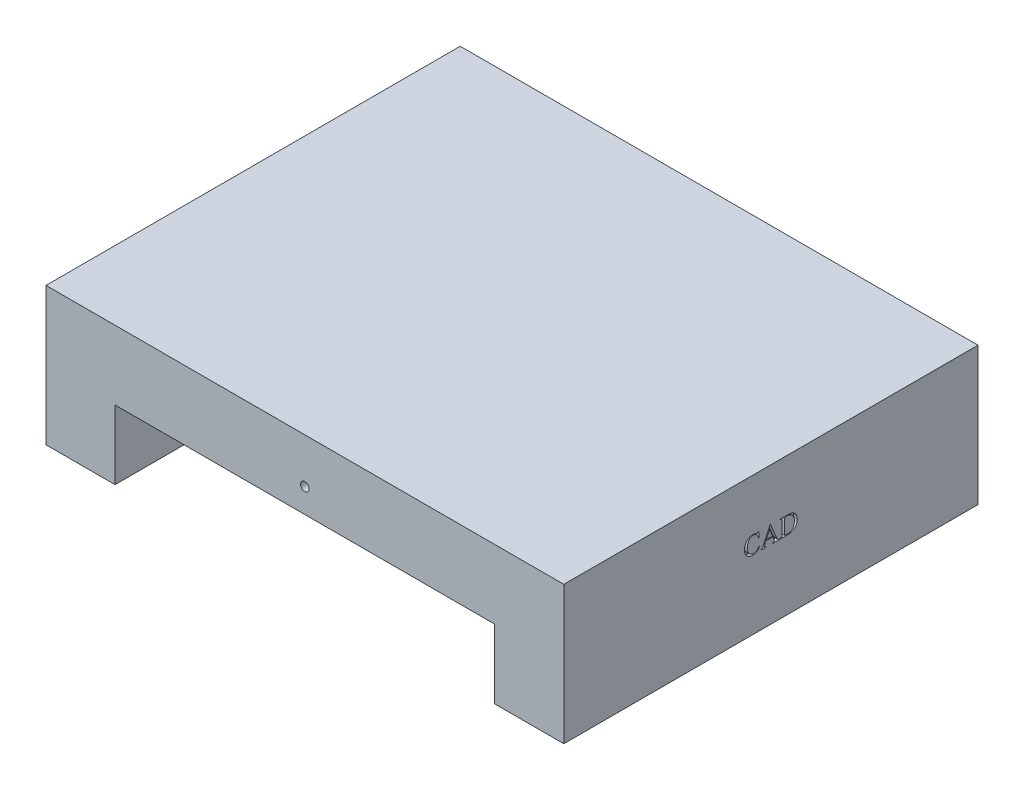
from build123d import *

# Parameters (mm, degrees)
SKETCH1_W           = 150
SKETCH1_H           = 40
BOSS_EXTRUDE1_DEPTH = 60
SKETCH2_W           = 110
SKETCH2_H           = 20
CUT_EXTRUDE1_DEPTH  = 143.91605928
SKETCH3_R           = 1.25
CUT_EXTRUDE2_DEPTH  = 5
CUT_EXTRUDE3_DEPTH  = 1


with BuildPart() as part:
    # Sketch1 → Boss-Extrude1 (new, symmetric)
    with BuildSketch(Plane.XY):
        Rectangle(SKETCH1_W, SKETCH1_H)
    extrude(amount=BOSS_EXTRUDE1_DEPTH, both=True)

    # Sketch2 → Cut-Extrude1 (cut, through all)
    with BuildSketch(Plane.XY.offset(60)):
        with Locations((0, -10)):
            Rectangle(SKETCH2_W, SKETCH2_H)
    extrude(amount=-CUT_EXTRUDE1_DEPTH, mode=Mode.SUBTRACT)

    # Sketch3 → Cut-Extrude2 (cut)
    with BuildSketch(Plane.XY.offset(60)):
        with Locations((0, 7)):
            Circle(SKETCH3_R)
    extrude(amount=-CUT_EXTRUDE2_DEPTH, mode=Mode.SUBTRACT)

    # Sketch4 → Cut-Extrude3 (cut)
    # profile 1 of 3: a face of its own
    with BuildSketch(Plane(origin=(75, 0, 0), x_dir=(0, 0, -1), z_dir=(1, 0, 0))):
        with BuildLine():
            Line((-3.541666667, 5.069444444), (-3.402777778, 3.333333333))
            Line((-3.402777778, 3.333333333), (-3.541666667, 3.333333333))
            add(Edge.make_bspline(
                [(-3.541666667, 3.333333333), (-3.560127797, 3.399019648), (-3.595893554, 3.526277332), (-3.659666525, 3.708188694), (-3.72687542, 3.876622986), (-3.80227413, 4.030002755), (-3.882169582, 4.169862856), (-3.969191355, 4.294933132), (-4.061446842, 4.406359345), (-4.159647569, 4.503713276), (-4.263693084, 4.587758073), (-4.372377784, 4.660574141), (-4.485902518, 4.72297205), (-4.604543404, 4.774290321), (-4.728887016, 4.813670152), (-4.858484508, 4.839782023), (-4.992585977, 4.858539417), (-5.083844223, 4.860244724), (-5.130208333, 4.861111111)],
                knots=[0, 0, 0, 0, 1.365306606, 2.645083058, 3.856296657, 4.992683601, 6.063002854, 7.077131597, 8.038305781, 8.954596039, 9.839848101, 10.711227855, 11.569763097, 12.429061007, 13.294496621, 14.174761977, 15.072680662, 16, 16, 16, 16], degree=3))
            add(Edge.make_bspline(
                [(-5.130208333, 4.861111111), (-5.169287844, 4.860089442), (-5.246507093, 4.858070671), (-5.360883492, 4.847678613), (-5.472048479, 4.8275014), (-5.580824898, 4.801086562), (-5.686129552, 4.764183666), (-5.789791277, 4.722690801), (-5.889530348, 4.671063555), (-5.986658971, 4.612448815), (-6.079895988, 4.545370393), (-6.168442528, 4.469056114), (-6.250695552, 4.382880321), (-6.328676248, 4.287686666), (-6.400174828, 4.182334195), (-6.469732236, 4.069550336), (-6.530813132, 3.945799573), (-6.588653986, 3.813990541), (-6.639210104, 3.672821607), (-6.683765793, 3.523606878), (-6.721903181, 3.366486083), (-6.751481957, 3.200376693), (-6.777442138, 3.026490305), (-6.79218997, 2.843423536), (-6.804207347, 2.652791522), (-6.805100567, 2.522808163), (-6.805555556, 2.456597222)],
                knots=[0, 0, 0, 0, 0.852545564, 1.684589362, 2.501652392, 3.314783632, 4.123040609, 4.933143274, 5.748109165, 6.569312519, 7.405645712, 8.25016084, 9.114918083, 10.000754889, 10.930732154, 11.889927012, 12.888317242, 13.937610583, 15.028084188, 16.156171809, 17.332859433, 18.552090647, 19.835038534, 21.165583881, 22.556204723, 24, 24, 24, 24], degree=3))
            add(Edge.make_bspline(
                [(-6.805555556, 2.456597222), (-6.804946869, 2.401605833), (-6.803748531, 2.293342773), (-6.793819055, 2.134039228), (-6.777574592, 1.980162537), (-6.754944485, 1.832039691), (-6.726034828, 1.689130362), (-6.688544954, 1.552541535), (-6.646524944, 1.420863258), (-6.598146101, 1.294702841), (-6.541430788, 1.175857854), (-6.479663213, 1.062934068), (-6.410200288, 0.957804512), (-6.33376384, 0.859723869), (-6.2514189, 0.768334354), (-6.162155265, 0.684467281), (-6.066030391, 0.608356468), (-5.964210791, 0.538953857), (-5.856940358, 0.477090531), (-5.745110622, 0.42395381), (-5.629592775, 0.379544139), (-5.510746875, 0.342424594), (-5.388278397, 0.313039481), (-5.261719437, 0.292415184), (-5.131523556, 0.28051361), (-5.043426681, 0.278696094), (-4.998914931, 0.277777778)],
                knots=[0, 0, 0, 0, 1.236646645, 2.434620225, 3.588021171, 4.71542926, 5.803413575, 6.864987612, 7.89909351, 8.911178466, 9.900886288, 10.858450138, 11.803739474, 12.731186558, 13.652621421, 14.567606934, 15.482266978, 16.407285251, 17.336514176, 18.264317902, 19.188799549, 20.117565524, 21.062609844, 22.018756131, 22.998958452, 24, 24, 24, 24], degree=3))
            add(Edge.make_bspline(
                [(-4.998914931, 0.277777778), (-4.922799118, 0.27985346), (-4.773966265, 0.283912139), (-4.557884156, 0.321965574), (-4.355251978, 0.382410079), (-4.196194366, 0.454594439), (-4.074860643, 0.528837328), (-3.980806535, 0.595266272), (-3.885754729, 0.675090232), (-3.787987089, 0.766393808), (-3.688371129, 0.870218925), (-3.584882083, 0.98478028), (-3.481463369, 1.113194093), (-3.413030322, 1.203524539), (-3.377821181, 1.25)],
                knots=[0, 0, 0, 0, 1.384369864, 2.706923932, 3.979392615, 5.225429667, 5.872362172, 6.566477539, 7.319183729, 8.12964106, 9.000244434, 9.937306366, 10.938733914, 12, 12, 12, 12], degree=3))
            Line((-3.377821181, 1.25), (-3.263888889, 1.180555556))
            add(Edge.make_bspline(
                [(-3.263888889, 1.180555556), (-3.294546158, 1.128200251), (-3.354758755, 1.025371494), (-3.450927393, 0.878788128), (-3.55209564, 0.743650218), (-3.657845328, 0.619982896), (-3.765604923, 0.50561585), (-3.87846188, 0.403169075), (-3.994014584, 0.310265407), (-4.115519049, 0.229998829), (-4.240729684, 0.158779484), (-4.371892922, 0.097914464), (-4.508197793, 0.045983661), (-4.65027668, 0.003201252), (-4.79839671, -0.028918323), (-4.951989518, -0.052770644), (-5.111480349, -0.067307385), (-5.219514938, -0.068723437), (-5.274522569, -0.069444444)],
                knots=[0, 0, 0, 0, 1.164115463, 2.286388121, 3.362177995, 4.401064794, 5.407448869, 6.375280312, 7.323730291, 8.2496411, 9.166480924, 10.085577234, 11.021398032, 11.963401182, 12.930012424, 13.927332932, 14.944666635, 16, 16, 16, 16], degree=3))
            add(Edge.make_bspline(
                [(-5.274522569, -0.069444444), (-5.324096727, -0.068939471), (-5.421921899, -0.067943003), (-5.56638095, -0.056433326), (-5.706963831, -0.039400567), (-5.843346858, -0.014912775), (-5.975062745, 0.018821425), (-6.103441395, 0.055248247), (-6.226329856, 0.103260215), (-6.34551672, 0.155678457), (-6.460321814, 0.216030543), (-6.571088451, 0.283093113), (-6.67730899, 0.358244506), (-6.779457497, 0.439774501), (-6.8776781, 0.527806327), (-6.97092707, 0.624023559), (-7.061207281, 0.726269572), (-7.116361323, 0.799674584), (-7.144097222, 0.836588542)],
                knots=[0, 0, 0, 0, 1.099867591, 2.170379506, 3.21370673, 4.241732154, 5.242319988, 6.230208013, 7.200627964, 8.167156574, 9.118536317, 10.076596279, 11.038581839, 12.003776478, 12.975622664, 13.963217193, 14.975741399, 16, 16, 16, 16], degree=3))
            add(Edge.make_bspline(
                [(-7.144097222, 0.836588542), (-7.183857385, 0.893424339), (-7.26281022, 1.006284724), (-7.362425055, 1.187483556), (-7.448602812, 1.374660437), (-7.518173052, 1.570481454), (-7.572699945, 1.773254504), (-7.609753065, 1.98391273), (-7.635082512, 2.201351616), (-7.637607909, 2.349100898), (-7.638888889, 2.424045139)],
                knots=[0, 0, 0, 0, 0.983524538, 1.953011393, 2.929009533, 3.904562341, 4.897931762, 5.904535192, 6.937097918, 8, 8, 8, 8], degree=3))
            add(Edge.make_bspline(
                [(-7.638888889, 2.424045139), (-7.637679207, 2.484833363), (-7.635285467, 2.605122268), (-7.621247854, 2.783806287), (-7.596600728, 2.958574943), (-7.559908779, 3.129255315), (-7.516117843, 3.297044039), (-7.46041206, 3.460671155), (-7.395373082, 3.620557223), (-7.320272394, 3.775410285), (-7.237642662, 3.92500264), (-7.144913191, 4.065712289), (-7.04625044, 4.198839844), (-6.939602001, 4.32281792), (-6.825427191, 4.438161898), (-6.703584062, 4.544769734), (-6.574112032, 4.642636436), (-6.437727993, 4.731393969), (-6.295683506, 4.810181586), (-6.150286975, 4.880080499), (-6.001229025, 4.938775426), (-5.848947954, 4.986646752), (-5.693731323, 5.02359376), (-5.535240941, 5.049360935), (-5.373637229, 5.066445014), (-5.264438885, 5.068439504), (-5.209418403, 5.069444444)],
                knots=[0, 0, 0, 0, 1.092083487, 2.161035764, 3.217773312, 4.260190825, 5.295679875, 6.331270849, 7.362920202, 8.394590017, 9.421399, 10.430623911, 11.419565072, 12.396371527, 13.365824252, 14.332813307, 15.302266032, 16.279072486, 17.253498857, 18.218389939, 19.175218244, 20.128753647, 21.083815363, 22.038788663, 23.011827579, 24, 24, 24, 24], degree=3))
            add(Edge.make_bspline(
                [(-5.209418403, 5.069444444), (-5.123169974, 5.06703775), (-4.950105444, 5.062208521), (-4.692543025, 5.019769592), (-4.436087364, 4.95468338), (-4.270952685, 4.889697558), (-4.187282986, 4.856770833)],
                knots=[0, 0, 0, 0, 0.984356359, 1.975191602, 2.974079167, 4, 4, 4, 4], degree=3))
            add(Edge.make_bspline(
                [(-4.187282986, 4.856770833), (-4.164592539, 4.84711199), (-4.122843604, 4.829340352), (-4.064997545, 4.808783687), (-4.017502596, 4.795351201), (-3.98913298, 4.792784381), (-3.976779514, 4.791666667)],
                knots=[0, 0, 0, 0, 1.336236462, 2.458587416, 3.328796419, 4, 4, 4, 4], degree=3))
            add(Edge.make_bspline(
                [(-3.976779514, 4.791666667), (-3.94627596, 4.793899801), (-3.886010248, 4.798311792), (-3.835639453, 4.831634094), (-3.810763889, 4.848090278)],
                knots=[0, 0, 0, 0, 1.012302122, 2, 2, 2, 2], degree=3))
            add(Edge.make_bspline(
                [(-3.810763889, 4.848090278), (-3.79608402, 4.862065295), (-3.766097958, 4.890611581), (-3.731233143, 4.943688415), (-3.700766592, 5.00312141), (-3.68747169, 5.046748972), (-3.680555556, 5.069444444)],
                knots=[0, 0, 0, 0, 0.931295945, 1.90232619, 2.908770141, 4, 4, 4, 4], degree=3))
            Line((-3.680555556, 5.069444444), (-3.541666667, 5.069444444))
        make_face()
    # profile 2 of 3: a face of its own
    with BuildSketch(Plane(origin=(75, 0, 0), x_dir=(0, 0, -1), z_dir=(1, 0, 0))):
        with BuildLine():
            Line((0.553385417, 1.666666667), (-1.439887153, 1.666666667))
            Line((-1.439887153, 1.666666667), (-1.805555556, 0.87890625))
            add(Edge.make_bspline(
                [(-1.805555556, 0.87890625), (-1.824230869, 0.834270326), (-1.858675129, 0.751944998), (-1.897877851, 0.635356662), (-1.924655467, 0.53685188), (-1.928595018, 0.476103923), (-1.930338542, 0.44921875)],
                knots=[0, 0, 0, 0, 1.290094603, 2.37941668, 3.282779777, 4, 4, 4, 4], degree=3))
            add(Edge.make_bspline(
                [(-1.930338542, 0.44921875), (-1.92925002, 0.430544653), (-1.927086893, 0.393435217), (-1.904089803, 0.340600358), (-1.870066397, 0.291462139), (-1.830963184, 0.253745589), (-1.790534833, 0.227446196), (-1.751595142, 0.20873886), (-1.704562511, 0.192741133), (-1.649556642, 0.17936528), (-1.586981319, 0.166198263), (-1.51688411, 0.153936637), (-1.438509503, 0.146056707), (-1.383829045, 0.141349163), (-1.355251736, 0.138888889)],
                knots=[0, 0, 0, 0, 0.928346294, 1.844823155, 2.832693264, 3.906787277, 4.533555799, 5.236980931, 6.060283213, 7.011752617, 8.064797478, 9.256587662, 10.566227436, 12, 12, 12, 12], degree=3))
            Line((-1.355251736, 0.138888889), (-1.355251736, 0))
            Line((-1.355251736, 0), (-2.925347222, 0))
            Line((-2.925347222, 0), (-2.925347222, 0.138888889))
            add(Edge.make_bspline(
                [(-2.925347222, 0.138888889), (-2.87777174, 0.148641637), (-2.791273973, 0.16637327), (-2.676142756, 0.200451126), (-2.58668341, 0.2382559), (-2.542172289, 0.273345832), (-2.522786458, 0.288628472)],
                knots=[0, 0, 0, 0, 1.341417684, 2.438853554, 3.320077337, 4, 4, 4, 4], degree=3))
            add(Edge.make_bspline(
                [(-2.522786458, 0.288628472), (-2.50658002, 0.305734104), (-2.472102733, 0.342124319), (-2.423141844, 0.406084632), (-2.373699828, 0.482203687), (-2.323078756, 0.570084331), (-2.270790897, 0.669709093), (-2.216817202, 0.780616703), (-2.162536998, 0.904331821), (-2.126914148, 0.990953871), (-2.108289931, 1.036241319)],
                knots=[0, 0, 0, 0, 0.657509844, 1.398774721, 2.244567789, 3.190193186, 4.229071695, 5.385194885, 6.63293641, 8, 8, 8, 8], degree=3))
            Line((-2.108289931, 1.036241319), (-0.233289931, 5.069444444))
            Line((-0.233289931, 5.069444444), (-0.096571181, 5.069444444))
            Line((-0.096571181, 5.069444444), (1.597222222, 0.948350694))
            add(Edge.make_bspline(
                [(1.597222222, 0.948350694), (1.613860368, 0.908763224), (1.645859565, 0.8326269), (1.697738836, 0.725542754), (1.745503316, 0.627837005), (1.793519951, 0.541774576), (1.839955181, 0.466614861), (1.885412105, 0.402298008), (1.929683964, 0.348566682), (1.988010143, 0.291545086), (2.069103635, 0.23385532), (2.182244256, 0.185997065), (2.310467224, 0.151590625), (2.402112277, 0.143253318), (2.450086806, 0.138888889)],
                knots=[0, 0, 0, 0, 1.223989839, 2.354029848, 3.391605643, 4.324042249, 5.162387765, 5.909171864, 6.567979791, 7.144041755, 8.231258465, 9.380841669, 10.628917946, 12, 12, 12, 12], degree=3))
            Line((2.450086806, 0.138888889), (2.450086806, 0))
            Line((2.450086806, 0), (0.476345486, 0))
            Line((0.476345486, 0), (0.476345486, 0.138888889))
            add(Edge.make_bspline(
                [(0.476345486, 0.138888889), (0.522049976, 0.141824368), (0.606024478, 0.14721783), (0.719030328, 0.169038273), (0.809780901, 0.196150186), (0.876855371, 0.236457974), (0.924319725, 0.284052367), (0.957621621, 0.335863297), (0.978422108, 0.392733035), (0.980790299, 0.432410056), (0.981987847, 0.452473958)],
                knots=[0, 0, 0, 0, 1.654818352, 3.040457217, 4.157564338, 5.061856313, 5.838989301, 6.56851638, 7.276126429, 8, 8, 8, 8], degree=3))
            add(Edge.make_bspline(
                [(0.981987847, 0.452473958), (0.980038239, 0.484446256), (0.975594755, 0.557316492), (0.943177106, 0.676865048), (0.898558521, 0.821007303), (0.857661232, 0.923307415), (0.835503472, 0.978732639)],
                knots=[0, 0, 0, 0, 0.698820548, 1.592729354, 2.695763756, 4, 4, 4, 4], degree=3))
            Line((0.835503472, 0.978732639), (0.553385417, 1.666666667))
        make_face()
        Polygon((0.467664931, 1.875), (-0.381944444, 3.882378472), (-1.343315972, 1.875), align=None, mode=Mode.SUBTRACT)
    # profile 3 of 3: a face of its own
    with BuildSketch(Plane(origin=(75, 0, 0), x_dir=(0, 0, -1), z_dir=(1, 0, 0))):
        with BuildLine():
            Line((2.569444444, 0), (2.569444444, 0.138888889))
            Line((2.569444444, 0.138888889), (2.750651042, 0.138888889))
            add(Edge.make_bspline(
                [(2.750651042, 0.138888889), (2.775279414, 0.139470136), (2.822934507, 0.14059483), (2.891719334, 0.150464302), (2.955082596, 0.166667026), (3.013066457, 0.189038716), (3.064518238, 0.219421682), (3.112167037, 0.253570209), (3.152665345, 0.296770037), (3.174633003, 0.329535222), (3.185763889, 0.346137153)],
                knots=[0, 0, 0, 0, 1.170016541, 2.263943595, 3.293731011, 4.273677885, 5.205400736, 6.126759273, 7.050839703, 8, 8, 8, 8], degree=3))
            add(Edge.make_bspline(
                [(3.185763889, 0.346137153), (3.192233993, 0.357923738), (3.206477371, 0.383870895), (3.222184583, 0.43001288), (3.234544886, 0.485396026), (3.245515106, 0.550230255), (3.253685032, 0.624507732), (3.260519051, 0.70879714), (3.263219646, 0.802572191), (3.263659404, 0.868417057), (3.263888889, 0.902777778)],
                knots=[0, 0, 0, 0, 0.568141805, 1.250715472, 2.052584266, 2.968455247, 4.031571596, 5.213625719, 6.545948453, 8, 8, 8, 8], degree=3))
            Line((3.263888889, 0.902777778), (3.263888889, 4.097222222))
            add(Edge.make_bspline(
                [(3.263888889, 4.097222222), (3.263939844, 4.135211574), (3.264036478, 4.207256974), (3.257815317, 4.309974656), (3.251005434, 4.401645773), (3.240368143, 4.482102399), (3.226502492, 4.551503747), (3.209226597, 4.609412995), (3.190986458, 4.658121421), (3.172541565, 4.683451378), (3.1640625, 4.695095486)],
                knots=[0, 0, 0, 0, 1.484107705, 2.814555366, 4.019988359, 5.075390106, 5.984573864, 6.780592097, 7.4394417, 8, 8, 8, 8], degree=3))
            add(Edge.make_bspline(
                [(3.1640625, 4.695095486), (3.139179083, 4.720769101), (3.08915632, 4.772380387), (2.99050509, 4.824963958), (2.875796819, 4.855284584), (2.793897101, 4.859097665), (2.750651042, 4.861111111)],
                knots=[0, 0, 0, 0, 0.928124107, 1.865794122, 2.873060895, 4, 4, 4, 4], degree=3))
            Line((2.750651042, 4.861111111), (2.569444444, 4.861111111))
            Line((2.569444444, 4.861111111), (2.569444444, 5))
            Line((2.569444444, 5), (4.618055556, 5))
            add(Edge.make_bspline(
                [(4.618055556, 5), (4.709215818, 4.999143286), (4.886191622, 4.997480087), (5.143131079, 4.985368329), (5.383558185, 4.966512035), (5.606593673, 4.938520283), (5.81297945, 4.902619962), (6.002805026, 4.860181466), (6.175757832, 4.808220383), (6.333132195, 4.747911984), (6.478950498, 4.678802027), (6.615342431, 4.598211044), (6.74488344, 4.507954507), (6.867563969, 4.407511187), (6.982057595, 4.29558276), (7.090192138, 4.173680556), (7.189959838, 4.040417353), (7.282847513, 3.898228279), (7.366406443, 3.747439541), (7.439022795, 3.589939165), (7.500936181, 3.426766986), (7.552365307, 3.257994763), (7.591410844, 3.083128512), (7.617611172, 2.902433124), (7.636297706, 2.716317475), (7.638016417, 2.590109006), (7.638888889, 2.526041667)],
                knots=[0, 0, 0, 0, 1.467398357, 2.848763231, 4.139747069, 5.348651221, 6.465709142, 7.510884705, 8.477890948, 9.369935066, 10.221521294, 11.072291092, 11.917022873, 12.760911509, 13.621447043, 14.491775058, 15.381421868, 16.298684439, 17.223858558, 18.153856654, 19.088127867, 20.031156851, 20.991691223, 21.969088183, 22.969046064, 24, 24, 24, 24], degree=3))
            add(Edge.make_bspline(
                [(7.638888889, 2.526041667), (7.637206894, 2.440583668), (7.633910105, 2.273082068), (7.602258339, 2.02735756), (7.552818592, 1.792360443), (7.483441138, 1.56755566), (7.392924594, 1.353956264), (7.282238983, 1.151294953), (7.154063172, 0.957494742), (7.05213786, 0.840233822), (7.000868056, 0.78125)],
                knots=[0, 0, 0, 0, 1.077719575, 2.112379846, 3.120154608, 4.104514829, 5.075810074, 6.041644454, 7.014920789, 8, 8, 8, 8], degree=3))
            add(Edge.make_bspline(
                [(7.000868056, 0.78125), (6.970538358, 0.74936335), (6.909663439, 0.685363463), (6.810744866, 0.596879349), (6.706475699, 0.514136775), (6.596150824, 0.437888252), (6.480273609, 0.367492585), (6.358293029, 0.303039293), (6.229963595, 0.246089109), (6.096591667, 0.193599574), (5.956931753, 0.148259958), (5.811844638, 0.108031889), (5.660470902, 0.074288194), (5.503191717, 0.047724008), (5.340393619, 0.0256958), (5.171679171, 0.010655104), (4.997196497, 0.002101176), (4.878843233, 0.000707248), (4.818793403, 0)],
                knots=[0, 0, 0, 0, 0.884547214, 1.775380039, 2.665826882, 3.559504879, 4.469980105, 5.390593375, 6.331323642, 7.291529335, 8.271228182, 9.282197471, 10.317896576, 11.387954191, 12.488469157, 13.620281033, 14.792583212, 16, 16, 16, 16], degree=3))
            Line((4.818793403, 0), (2.569444444, 0))
        make_face()
        with BuildLine():
            add(Edge.make_bspline(
                [(3.958333333, 0.314670139), (4.035221917, 0.298273802), (4.181921261, 0.26699046), (4.393972778, 0.235444417), (4.586085249, 0.212364085), (4.708058188, 0.209625735), (4.765625, 0.208333333)],
                knots=[0, 0, 0, 0, 1.156263879, 2.206090244, 3.153339526, 4, 4, 4, 4], degree=3))
            add(Edge.make_bspline(
                [(4.765625, 0.208333333), (4.83734737, 0.210121917), (4.978513977, 0.213642274), (5.185234016, 0.244027053), (5.383178125, 0.291375608), (5.571739606, 0.358864928), (5.750746707, 0.446202074), (5.919997702, 0.553153713), (6.078681198, 0.680412577), (6.228598684, 0.823803236), (6.363423151, 0.985319036), (6.482823049, 1.160780615), (6.582726881, 1.350596087), (6.664236379, 1.553998865), (6.72848522, 1.77081022), (6.773471295, 2.001871189), (6.801105547, 2.246502604), (6.80404946, 2.414204372), (6.805555556, 2.5)],
                knots=[0, 0, 0, 0, 0.997996022, 1.964292496, 2.902202989, 3.827540679, 4.746320531, 5.669683403, 6.608607029, 7.573643287, 8.552931756, 9.531909504, 10.522958759, 11.532773866, 12.577887131, 13.666093008, 14.805981493, 16, 16, 16, 16], degree=3))
            add(Edge.make_bspline(
                [(6.805555556, 2.5), (6.804052965, 2.586517745), (6.801121648, 2.755300207), (6.773594595, 3.001039925), (6.728328192, 3.232764515), (6.664223691, 3.450313775), (6.582945968, 3.654552824), (6.483069847, 3.844445231), (6.363449682, 4.019111092), (6.22814677, 4.179386682), (6.078871145, 4.323594647), (5.917650566, 4.449041171), (5.745816666, 4.554947854), (5.56406163, 4.642901831), (5.370423208, 4.708010295), (5.168126341, 4.757861955), (4.954853474, 4.78595614), (4.80946801, 4.789736596), (4.735243056, 4.791666667)],
                knots=[0, 0, 0, 0, 1.193396302, 2.328127765, 3.406675227, 4.447298146, 5.452780722, 6.435033879, 7.401194227, 8.367973033, 9.324444072, 10.259799173, 11.180785527, 12.104889921, 13.03919269, 13.994204462, 14.975963072, 16, 16, 16, 16], degree=3))
            add(Edge.make_bspline(
                [(4.735243056, 4.791666667), (4.67659607, 4.790377429), (4.554626865, 4.787696178), (4.366166158, 4.765767533), (4.165586717, 4.730797543), (4.029074854, 4.698705172), (3.958333333, 4.682074653)],
                knots=[0, 0, 0, 0, 0.894670856, 1.860663297, 2.891378894, 4, 4, 4, 4], degree=3))
            Line((3.958333333, 4.682074653), (3.958333333, 0.314670139))
        make_face(mode=Mode.SUBTRACT)
    extrude(amount=-CUT_EXTRUDE3_DEPTH, mode=Mode.SUBTRACT)


solid = part.part
